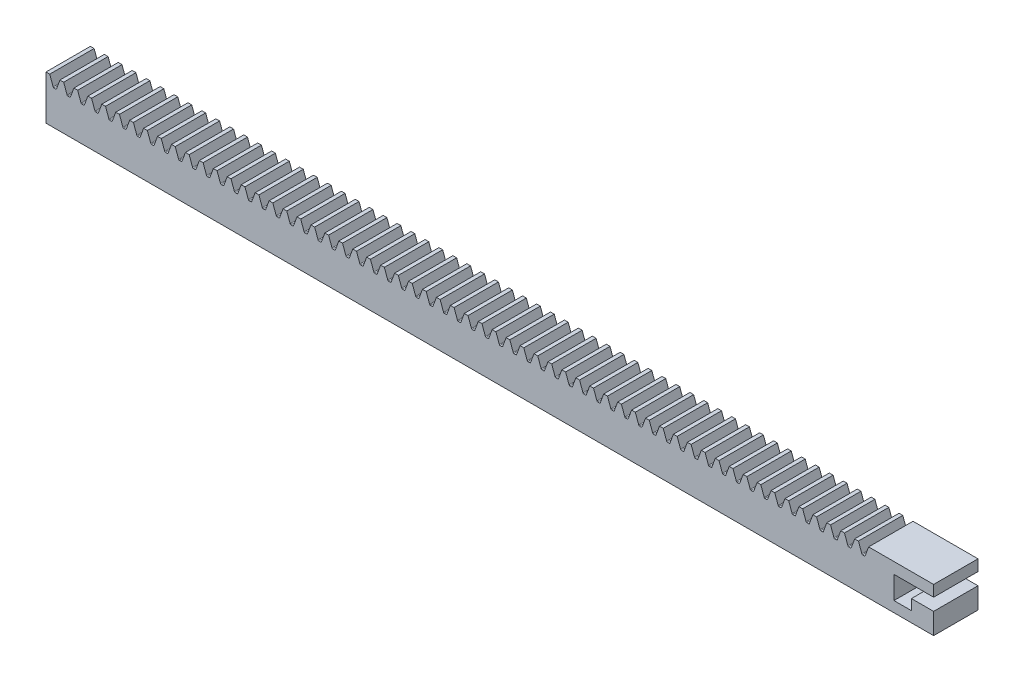
from build123d import *

# Parameters (mm, degrees)
SKETCH1_W              = 254
SKETCH1_H              = 12.7
BOSS_EXTRUDE1_DEPTH    = 6.35
CUT_EXTRUDE1_DEPTH     = 12.7
FILLET3_R              = 0.254566605
LPATTERN4_COUNT        = 59
LPATTERN4_PITCH        = 3.989832
FILLET3_OF_LPATTERN4_R = 0.254566605
CUT_EXTRUDE2_DEPTH     = 128.791284914


with BuildPart() as part:
    # Sketch1 → Boss-Extrude1 (new, symmetric)
    with BuildSketch(Plane.XY):
        Rectangle(SKETCH1_W, SKETCH1_H)
    extrude(amount=BOSS_EXTRUDE1_DEPTH, both=True)

    # Sketch2 → Cut-Extrude1 (cut)
    with BuildSketch(Plane.XY.offset(6.35)):
        Polygon((-125.929568395, 6.35), (-124.894145873, 3.5052), (-124.045590522, 3.5052), (-123.010168, 6.35), align=None)
    cut_extrude1 = extrude(amount=-CUT_EXTRUDE1_DEPTH, mode=Mode.SUBTRACT)

    # Fillet3
    fillet3_edges = [part.edges().sort_by_distance(p)[0] for p in [
        (-124.045590522, 3.5052, 0),
        (-124.894145873, 3.5052, 0),
    ]]
    fillet(fillet3_edges, radius=FILLET3_R)

    # LPattern4: Cut-Extrude1 ×59
    with Locations(*[(i * LPATTERN4_PITCH, 0, 0) for i in range(1, LPATTERN4_COUNT)]):
        add(cut_extrude1, mode=Mode.SUBTRACT)

    # Fillet3 of LPattern4
    fillet3_of_lpattern4_edges = [part.edges().sort_by_distance(p)[0] for p in [
        (-120.055758522, 3.5052, 0),
        (-120.904313873, 3.5052, 0),
        (-116.065926522, 3.5052, 0),
        (-116.914481873, 3.5052, 0),
        (-112.076094522, 3.5052, 0),
        (-112.924649873, 3.5052, 0),
        (-108.086262522, 3.5052, 0),
        (-108.934817873, 3.5052, 0),
        (-104.096430522, 3.5052, 0),
        (-104.944985873, 3.5052, 0),
        (-100.106598522, 3.5052, 0),
        (-100.955153873, 3.5052, 0),
        (-96.116766522, 3.5052, 0),
        (-96.965321873, 3.5052, 0),
        (-92.126934522, 3.5052, 0),
        (-92.975489873, 3.5052, 0),
        (-88.137102522, 3.5052, 0),
        (-88.985657873, 3.5052, 0),
        (-84.147270522, 3.5052, 0),
        (-84.995825873, 3.5052, 0),
        (-80.157438522, 3.5052, 0),
        (-81.005993873, 3.5052, 0),
        (-76.167606522, 3.5052, 0),
        (-77.016161873, 3.5052, 0),
        (-72.177774522, 3.5052, 0),
        (-73.026329873, 3.5052, 0),
        (-68.187942522, 3.5052, 0),
        (-69.036497873, 3.5052, 0),
        (-64.198110522, 3.5052, 0),
        (-65.046665873, 3.5052, 0),
        (-60.208278522, 3.5052, 0),
        (-61.056833873, 3.5052, 0),
        (-56.218446522, 3.5052, 0),
        (-57.067001873, 3.5052, 0),
        (-52.228614522, 3.5052, 0),
        (-53.077169873, 3.5052, 0),
        (-48.238782522, 3.5052, 0),
        (-49.087337873, 3.5052, 0),
        (-44.248950522, 3.5052, 0),
        (-45.097505873, 3.5052, 0),
        (-40.259118522, 3.5052, 0),
        (-41.107673873, 3.5052, 0),
        (-36.269286522, 3.5052, 0),
        (-37.117841873, 3.5052, 0),
        (-32.279454522, 3.5052, 0),
        (-33.128009873, 3.5052, 0),
        (-28.289622522, 3.5052, 0),
        (-29.138177873, 3.5052, 0),
        (-24.299790522, 3.5052, 0),
        (-25.148345873, 3.5052, 0),
        (-20.309958522, 3.5052, 0),
        (-21.158513873, 3.5052, 0),
        (-16.320126522, 3.5052, 0),
        (-17.168681873, 3.5052, 0),
        (-12.330294522, 3.5052, 0),
        (-13.178849873, 3.5052, 0),
        (-8.340462522, 3.5052, 0),
        (-9.189017873, 3.5052, 0),
        (-4.350630522, 3.5052, 0),
        (-5.199185873, 3.5052, 0),
        (-0.360798522, 3.5052, 0),
        (-1.209353873, 3.5052, 0),
        (3.629033478, 3.5052, 0),
        (2.780478127, 3.5052, 0),
        (7.618865478, 3.5052, 0),
        (6.770310127, 3.5052, 0),
        (11.608697478, 3.5052, 0),
        (10.760142127, 3.5052, 0),
        (15.598529478, 3.5052, 0),
        (14.749974127, 3.5052, 0),
        (19.588361478, 3.5052, 0),
        (18.739806127, 3.5052, 0),
        (23.578193478, 3.5052, 0),
        (22.729638127, 3.5052, 0),
        (27.568025478, 3.5052, 0),
        (26.719470127, 3.5052, 0),
        (31.557857478, 3.5052, 0),
        (30.709302127, 3.5052, 0),
        (35.547689478, 3.5052, 0),
        (34.699134127, 3.5052, 0),
        (39.537521478, 3.5052, 0),
        (38.688966127, 3.5052, 0),
        (43.527353478, 3.5052, 0),
        (42.678798127, 3.5052, 0),
        (47.517185478, 3.5052, 0),
        (46.668630127, 3.5052, 0),
        (51.507017478, 3.5052, 0),
        (50.658462127, 3.5052, 0),
        (55.496849478, 3.5052, 0),
        (54.648294127, 3.5052, 0),
        (59.486681478, 3.5052, 0),
        (58.638126127, 3.5052, 0),
        (63.476513478, 3.5052, 0),
        (62.627958127, 3.5052, 0),
        (67.466345478, 3.5052, 0),
        (66.617790127, 3.5052, 0),
        (71.456177478, 3.5052, 0),
        (70.607622127, 3.5052, 0),
        (75.446009478, 3.5052, 0),
        (74.597454127, 3.5052, 0),
        (79.435841478, 3.5052, 0),
        (78.587286127, 3.5052, 0),
        (83.425673478, 3.5052, 0),
        (82.577118127, 3.5052, 0),
        (87.415505478, 3.5052, 0),
        (86.566950127, 3.5052, 0),
        (91.405337478, 3.5052, 0),
        (90.556782127, 3.5052, 0),
        (95.395169478, 3.5052, 0),
        (94.546614127, 3.5052, 0),
        (99.385001478, 3.5052, 0),
        (98.536446127, 3.5052, 0),
        (103.374833478, 3.5052, 0),
        (102.526278127, 3.5052, 0),
        (107.364665478, 3.5052, 0),
        (106.516110127, 3.5052, 0),
    ]]
    fillet(fillet3_of_lpattern4_edges, radius=FILLET3_OF_LPATTERN4_R)

    # Sketch3 → Cut-Extrude2 (cut, through all)
    with BuildSketch(Plane.XY.offset(6.35)):
        Polygon((127, 3.175), (115.65, 3.175), (115.65, -3.325), (120.65, -3.325), (120.65, -0.325), (127, -0.325), align=None)
    extrude(amount=-CUT_EXTRUDE2_DEPTH, mode=Mode.SUBTRACT)


solid = part.part
